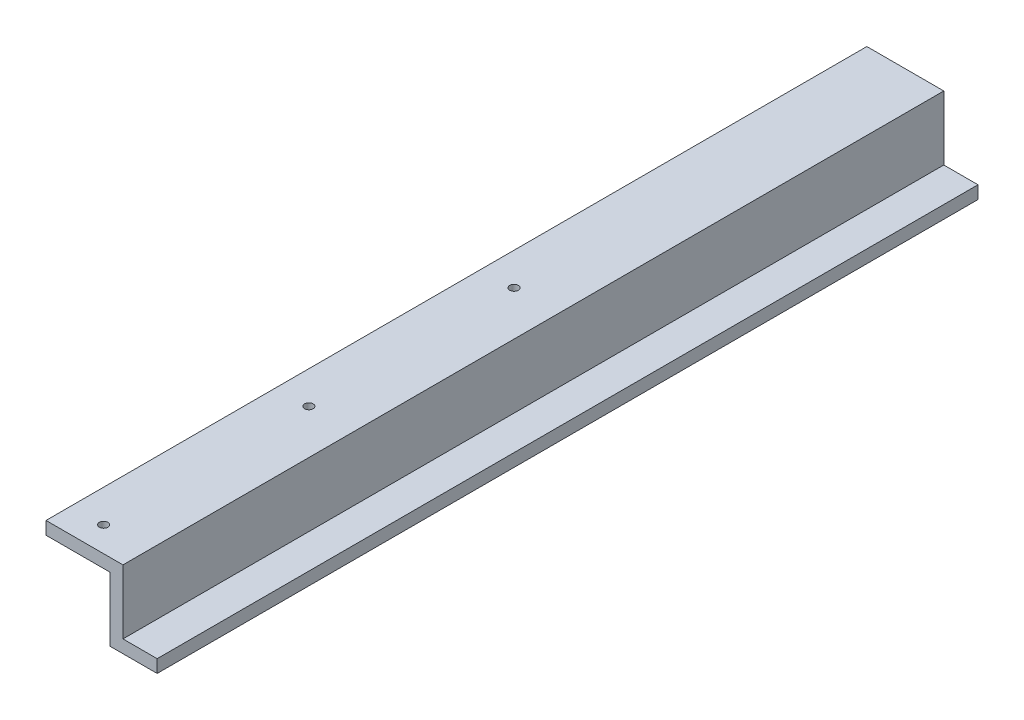
from build123d import *

# Parameters (mm, degrees)
BOSS_EXTRUDE1_DEPTH      = 152.4
BOSS_EXTRUDE1_DEPTH_BACK = 152.4
SKETCH6_R                = 1.5875
CUT_EXTRUDE1_DEPTH       = 4.7625


with BuildPart() as part:
    # Sketch3 → Boss-Extrude1 (new, two sides: drawn at the far end of the back side and taken through both)
    with BuildSketch(Plane.XY.offset(-BOSS_EXTRUDE1_DEPTH_BACK)):
        Polygon((15.08125, -9.525), (15.08125, -14.2875), (-2.38125, -14.2875), (-2.38125, 9.525), (-26.19375, 9.525), (-26.19375, 14.2875), (2.38125, 14.2875), (2.38125, -9.525), align=None)
    extrude(amount=BOSS_EXTRUDE1_DEPTH + BOSS_EXTRUDE1_DEPTH_BACK)

    # Sketch6 → Cut-Extrude1 (cut)
    with BuildSketch(Plane.XZ.offset(-9.525)):
        with Locations(Location((-14.09580281, 143.094207794, 0), (0, 0, 270))):
            Circle(SKETCH6_R)
        with Locations(Location((-14.09580281, 66.894207794, 0), (0, 0, 270))):
            Circle(SKETCH6_R)
        with Locations(Location((-14.09580281, -9.305792206, 0), (0, 0, 270))):
            Circle(SKETCH6_R)
    extrude(amount=-CUT_EXTRUDE1_DEPTH, mode=Mode.SUBTRACT)


solid = part.part
